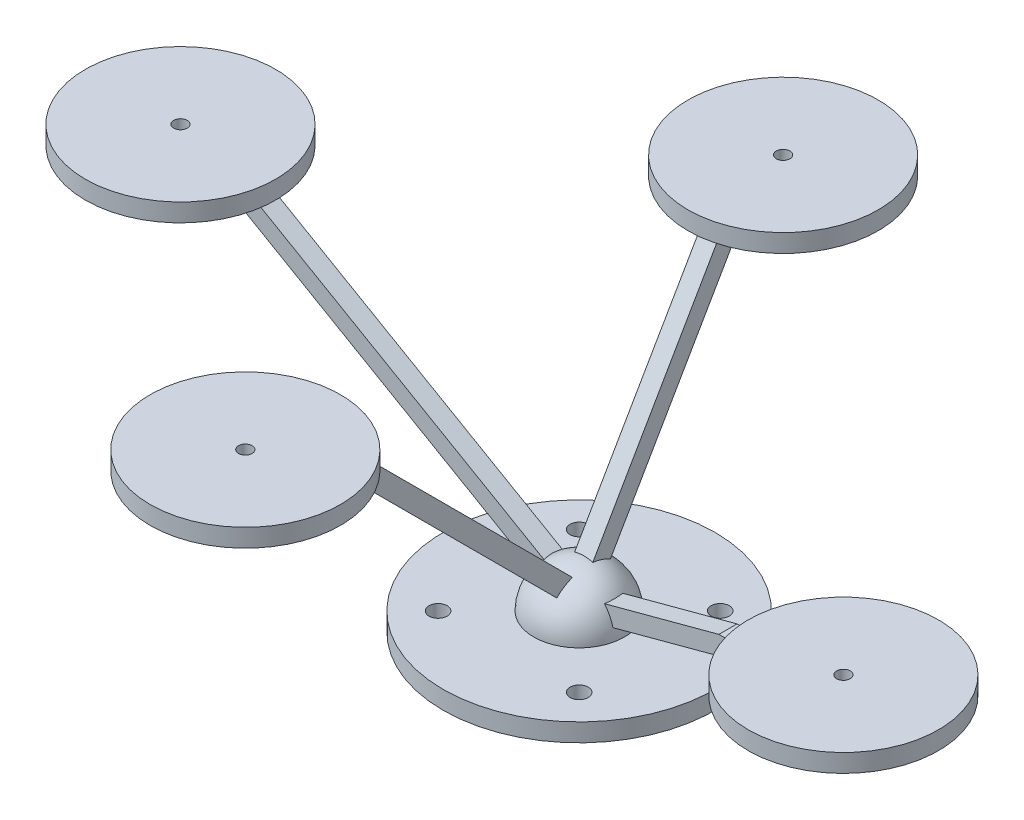
from build123d import *

# Parameters (mm, degrees)
SKETCH_1_R      = 15
SKETCH_1_R_2    = 1
EXTRUDE_1_DEPTH = 2
EXTRUDE_2_DEPTH = 1
SKETCH_4_R      = 10.5
SKETCH_4_R_2    = 0.75
EXTRUDE_3_DEPTH = 2
SKETCH_5_R      = 10.5
SKETCH_5_R_2    = 0.75
EXTRUDE_4_DEPTH = 2
EXTRUDE_5_DEPTH = 1
SKETCH_7_R      = 10.5
SKETCH_7_R_2    = 0.75
EXTRUDE_6_DEPTH = 2
SKETCH_8_R      = 10.5
SKETCH_8_R_2    = 0.75
EXTRUDE_7_DEPTH = 2


with BuildPart() as part:
    # 草图1 → 凸台-拉伸1 (new body)
    with BuildSketch(Plane(origin=(0, 0, 0), x_dir=(1, 0, 0), z_dir=(0, 1, 0))):
        with Locations(Location((0, 0, 0), (0, 0, 270))):
            Circle(SKETCH_1_R)
        with Locations(Location((7.778174593, 7.778174593, 0), (0, 0, 270))):
            Circle(SKETCH_1_R_2, mode=Mode.SUBTRACT)
        with Locations(Location((-7.778174593, 7.778174593, 0), (0, 0, 270))):
            Circle(SKETCH_1_R_2, mode=Mode.SUBTRACT)
        with Locations(Location((-7.778174593, -7.778174593, 0), (0, 0, 270))):
            Circle(SKETCH_1_R_2, mode=Mode.SUBTRACT)
        with Locations(Location((7.778174593, -7.778174593, 0), (0, 0, 270))):
            Circle(SKETCH_1_R_2, mode=Mode.SUBTRACT)
    extrude(amount=EXTRUDE_1_DEPTH)

    # 草图2 → 旋转1 (revolve)
    with BuildSketch(Plane(origin=(0, 0, 0), x_dir=(0, 0, -1), z_dir=(1, 0, 0))):
        with BuildLine():
            Line((0, 2), (0, 7))
            ThreePointArc((0, 7), (3.535533906, 5.535533906), (5, 2))
            Line((5, 2), (0, 2))
        make_face()
    revolve(axis=Axis((0, 2, 0), (0, 1, 0)))

    # 草图3 → 凸台-拉伸2 (add, symmetric)
    with BuildSketch(Plane.XY):
        Polygon((0, 2), (24.148145657, 8.470476128), (16.420739047, 8.470476128), (0, 4.070552361), (0, 4.309401077), (-34.97114317, 24.5), (-38.97114317, 24.5), align=None)
    extrude(amount=EXTRUDE_2_DEPTH, both=True)

    # 草图4 → 凸台-拉伸3 (add)
    with BuildSketch(Plane(origin=(0, 8.470476128, 0), x_dir=(1, 0, 0), z_dir=(0, 1, 0))):
        with Locations(Location((29.148145657, 0, 0), (0, 0, 174.5349762))):
            Circle(SKETCH_4_R)
        with Locations(Location((29.148145657, 0, 0), (0, 0, 270))):
            Circle(SKETCH_4_R_2, mode=Mode.SUBTRACT)
    extrude(amount=EXTRUDE_3_DEPTH)

    # 草图5 → 凸台-拉伸4 (add)
    with BuildSketch(Plane(origin=(0, 24.5, 0), x_dir=(1, 0, 0), z_dir=(0, 1, 0))):
        with Locations(Location((-43.97114317, 0, 0), (0, 0, 270))):
            Circle(SKETCH_5_R)
        with Locations(Location((-43.97114317, 0, 0), (0, 0, 270))):
            Circle(SKETCH_5_R_2, mode=Mode.SUBTRACT)
    extrude(amount=EXTRUDE_4_DEPTH)

    # 草图6 → 凸台-拉伸5 (add, symmetric)
    with BuildSketch(Plane(origin=(0, 0, 0), x_dir=(0, 0, -1), z_dir=(1, 0, 0))):
        Polygon((0, 2), (17.5, 32.310889132), (15.190598923, 32.310889132), (0, 6), (0, 4.828427125), (-28.991378029, 33.819805153), (-31.819805153, 33.819805153), align=None)
    extrude(amount=EXTRUDE_5_DEPTH, both=True)

    # 草图7 → 凸台-拉伸6 (add)
    with BuildSketch(Plane(origin=(0, 32.310889132, 0), x_dir=(1, 0, 0), z_dir=(0, 1, 0))):
        with Locations(Location((0, 22.5, 0), (0, 0, 270))):
            Circle(SKETCH_7_R)
        with Locations(Location((0, 22.5, 0), (0, 0, 270))):
            Circle(SKETCH_7_R_2, mode=Mode.SUBTRACT)
    extrude(amount=EXTRUDE_6_DEPTH)

    # 草图8 → 凸台-拉伸7 (add)
    with BuildSketch(Plane(origin=(0, 33.819805153, 0), x_dir=(1, 0, 0), z_dir=(0, 1, 0))):
        with Locations(Location((0, -36.819805153, 0), (0, 0, 270))):
            Circle(SKETCH_8_R)
        with Locations(Location((0, -36.819805153, 0), (0, 0, 270))):
            Circle(SKETCH_8_R_2, mode=Mode.SUBTRACT)
    extrude(amount=EXTRUDE_7_DEPTH)


solid = part.part
